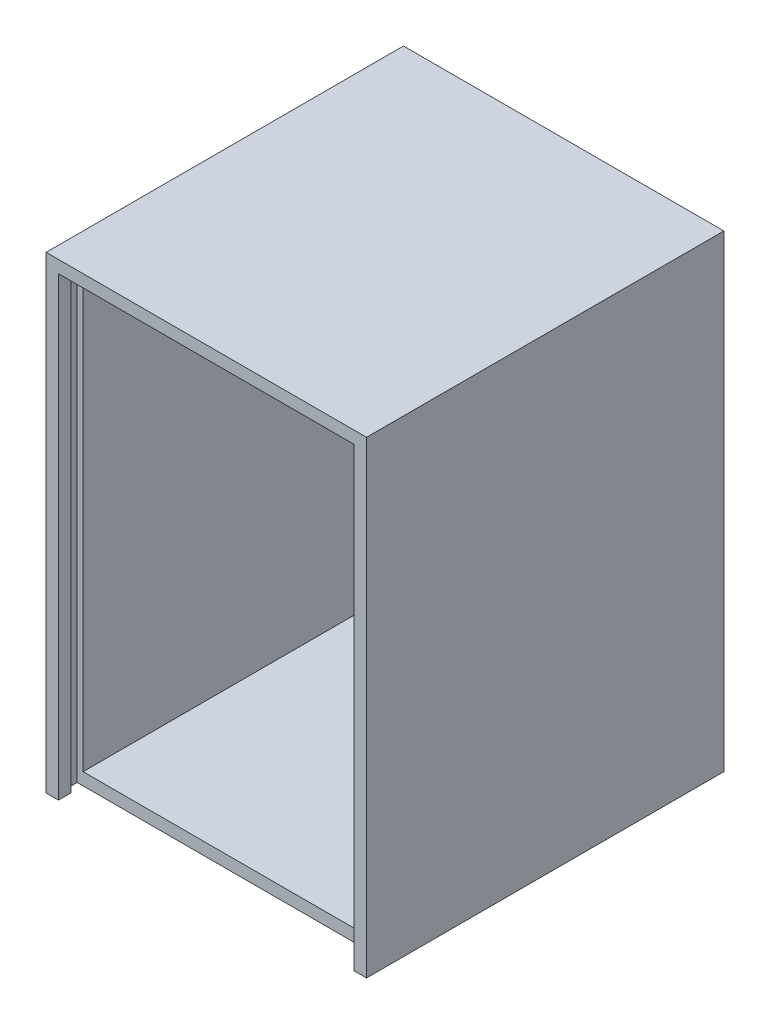
from build123d import *

# Parameters (mm, degrees)
SKETCH1_W           = 130
SKETCH1_H           = 190
BOSS_EXTRUDE1_DEPTH = 5
SKETCH2_W           = 130
SKETCH2_H           = 190
SKETCH2_W_2         = 120
SKETCH2_H_2         = 180
BOSS_EXTRUDE2_DEPTH = 130
BOSS_EXTRUDE3_DEPTH = 10
SKETCH4_W           = 2.4
SKETCH4_H           = 5
CUT_EXTRUDE1_DEPTH  = 187.4
SKETCH5_W           = 120
SKETCH5_H           = 5
CUT_EXTRUDE2_DEPTH  = 2.4


with BuildPart() as part:
    # Sketch1 → Boss-Extrude1 (new body)
    with BuildSketch(Plane.XY):
        with Locations((65, -95)):
            Rectangle(SKETCH1_W, SKETCH1_H)
    extrude(amount=BOSS_EXTRUDE1_DEPTH)

    # Sketch2 → Boss-Extrude2 (add)
    with BuildSketch(Plane.XY.offset(5)):
        with Locations((65, -95)):
            Rectangle(SKETCH2_W, SKETCH2_H)
        with Locations((65, -95)):
            Rectangle(SKETCH2_W_2, SKETCH2_H_2, mode=Mode.SUBTRACT)
    extrude(amount=BOSS_EXTRUDE2_DEPTH)

    # Sketch3 → Boss-Extrude3 (add)
    with BuildSketch(Plane.XY.offset(135)):
        Polygon((0, -190), (0, 0), (130, 0), (130, -190), (125, -190), (125, -185), (125, -5), (5, -5), (5, -190), align=None)
    extrude(amount=BOSS_EXTRUDE3_DEPTH)

    # Sketch4 → Cut-Extrude1 (cut)
    with BuildSketch(Plane.XZ.offset(190)):
        with Locations((3.8, 137.5)):
            Rectangle(SKETCH4_W, SKETCH4_H)
        with Locations((126.2, 137.5)):
            Rectangle(SKETCH4_W, SKETCH4_H)
    extrude(amount=-CUT_EXTRUDE1_DEPTH, mode=Mode.SUBTRACT)

    # Sketch5 → Cut-Extrude2 (cut)
    with BuildSketch(Plane.XZ.offset(5)):
        with Locations((65, 137.5)):
            Rectangle(SKETCH5_W, SKETCH5_H)
    extrude(amount=-CUT_EXTRUDE2_DEPTH, mode=Mode.SUBTRACT)


solid = part.part
